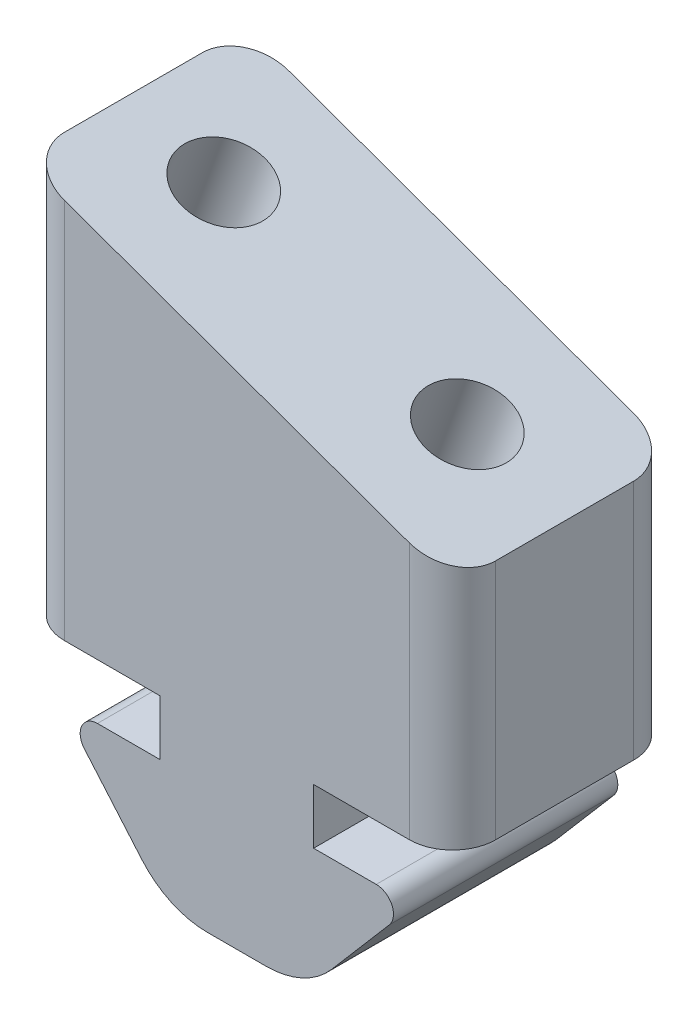
from build123d import *

# Parameters (mm, degrees)
BOSS_EXTRUDE3_DEPTH = 13
FILLET1_R           = 1
FILLET2_R           = 5
SKETCH2_R           = 2.4
CUT_EXTRUDE1_DEPTH  = 7.5
FILLET3_R           = 2.5


with BuildPart() as part:
    # Sketch1 → Boss-Extrude3 (new body)
    with BuildSketch(Plane.XY):
        Polygon((-12.5, 10.5), (-4.45, 10.5), (4.45, 10.5), (12.5, 10.5), (12.5, 24.5), (-12.5, 33.5), align=None)
        Polygon((-4.45, 7.3), (-10.25, 7.3), (-4, 0), (4, 0), (10.25, 7.3), (4.45, 7.3), (4.45, 10.5), (-4.45, 10.5), align=None)
    extrude(amount=BOSS_EXTRUDE3_DEPTH)

    # Fillet1
    fillet1_edges = [part.edges().sort_by_distance(p)[0] for p in [
        (10.25, 7.3, 6.5),
        (-10.25, 7.3, 6.5),
    ]]
    fillet(fillet1_edges, radius=FILLET1_R)

    # Fillet2
    fillet2_edges = [part.edges().sort_by_distance(p)[0] for p in [
        (4, 0, 6.5),
        (-4, 0, 6.5),
    ]]
    fillet(fillet2_edges, radius=FILLET2_R)

    # Sketch2 → Cut-Extrude1 (cut)
    with BuildSketch(Plane(origin=(9.242209632, 25.672804533, 0), x_dir=(0.9408874118687268, -0.33871946827274163, 0), z_dir=(0.33871946827274163, 0.9408874118687268, 0))):
        with Locations(Location((-17.537534324, -6.5, 0), (0, 0, 180))):
            Circle(SKETCH2_R)
        with Locations(Location((-2.537534324, -6.5, 0), (0, 0, 180))):
            Circle(SKETCH2_R)
    extrude(amount=-CUT_EXTRUDE1_DEPTH, mode=Mode.SUBTRACT)

    # Fillet3
    fillet3_edges = [part.edges().sort_by_distance(p)[0] for p in [
        (-12.5, 22, 13),
        (-12.5, 22, 0),
        (12.5, 17.5, 0),
        (12.5, 17.5, 13),
    ]]
    fillet(fillet3_edges, radius=FILLET3_R)


solid = part.part
